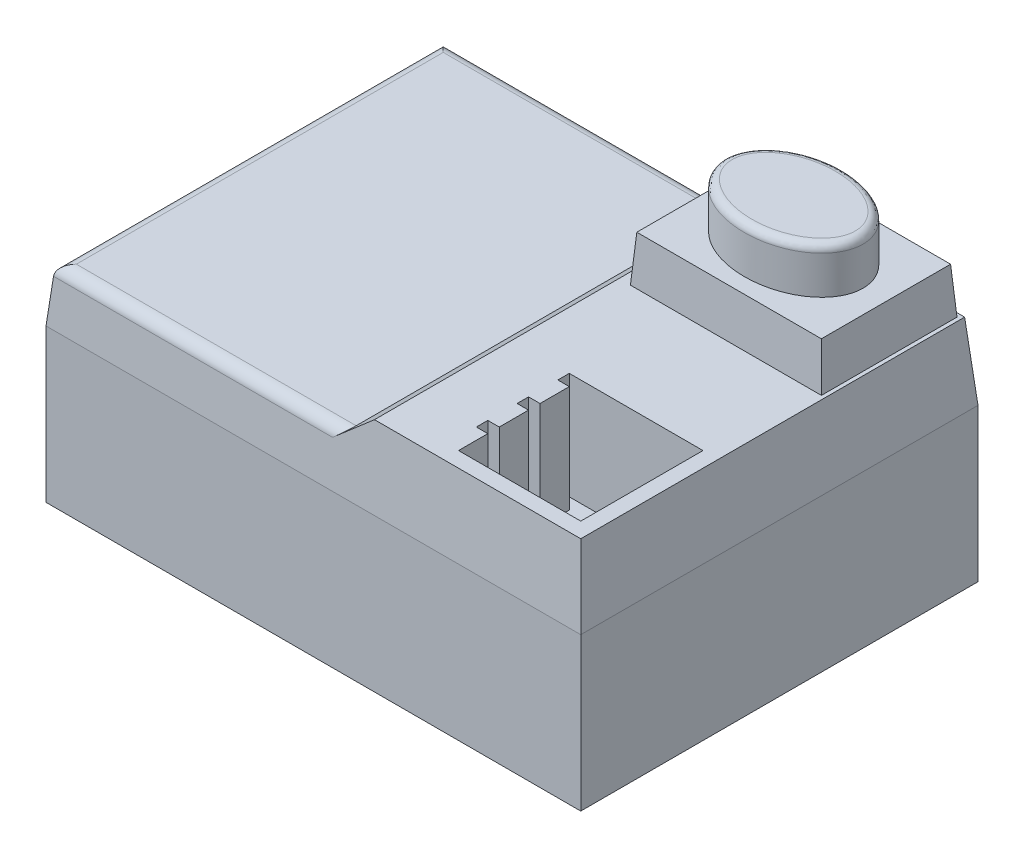
from build123d import *

# Parameters (mm, degrees)
SKETCH1_W           = 35
SKETCH1_H           = 26
BOSS_EXTRUDE1_DEPTH = 10
SKETCH2_W           = 35
SKETCH2_H           = 26
BOSS_EXTRUDE3_DEPTH = 5
BOSS_EXTRUDE3_TAPER = 5
CUT_EXTRUDE1_DEPTH  = 35.745503475
CUT_EXTRUDE2_DEPTH  = 7
SKETCH5_W           = 12.5
SKETCH5_H           = 8.875113364
BOSS_EXTRUDE4_DEPTH = 3
BOSS_EXTRUDE4_TAPER = 4
SKETCH6_RX          = 4.540219564
SKETCH6_RY          = 3.227776247
BOSS_EXTRUDE5_DEPTH = 3
FILLET1_R           = 0.5
FILLET2_R           = 0.75


with BuildPart() as part:
    # Sketch1 → Boss-Extrude1 (new body)
    with BuildSketch(Plane(origin=(0, 0, 0), x_dir=(1, 0, 0), z_dir=(0, 1, 0))):
        Rectangle(SKETCH1_W, SKETCH1_H)
    extrude(amount=BOSS_EXTRUDE1_DEPTH)

    # Sketch2 → Boss-Extrude3 (add)
    with BuildSketch(Plane(origin=(0, 10, 0), x_dir=(1, 0, 0), z_dir=(0, 1, 0))):
        Rectangle(SKETCH2_W, SKETCH2_H)
    extrude(amount=BOSS_EXTRUDE3_DEPTH, taper=BOSS_EXTRUDE3_TAPER)

    # Sketch3 → Cut-Extrude1 (cut, through all)
    with BuildSketch(Plane.XY.offset(13)):
        Polygon((-17.500926093, 15), (3.562556682, 15), (1.806210322, 13.5), (-17.500926093, 13.5), align=None)
    extrude(amount=-CUT_EXTRUDE1_DEPTH, mode=Mode.SUBTRACT)

    # Sketch4 → Cut-Extrude2 (cut)
    with BuildSketch(Plane(origin=(0, 15, 0), x_dir=(1, 0, 0), z_dir=(0, 1, 0))):
        Polygon((8.062556682, -6.229226682), (8.062556682, -4.312556682), (7.312556682, -4.312556682), (7.312556682, -3.562556682), (8.062556682, -3.562556682), (16.062556682, -3.562556682), (16.062556682, -11.562556682), (8.062556682, -11.562556682), (8.062556682, -9.645896682), (7.312556682, -9.645896682), (7.312556682, -8.895896682), (8.062556682, -8.895896682), (8.062556682, -6.979226682), (7.312556682, -6.979226682), (7.312556682, -6.229226682), align=None)
    extrude(amount=-CUT_EXTRUDE2_DEPTH, mode=Mode.SUBTRACT)

    # Sketch5 → Boss-Extrude4 (add)
    with BuildSketch(Plane(origin=(0, 15, 0), x_dir=(1, 0, 0), z_dir=(0, 1, 0))):
        with Locations((10.562556682, 7.875)):
            Rectangle(SKETCH5_W, SKETCH5_H)
    extrude(amount=BOSS_EXTRUDE4_DEPTH, taper=BOSS_EXTRUDE4_TAPER)

    # Sketch6 → Boss-Extrude5 (add)
    with BuildSketch(Plane(origin=(0, 18, 0), x_dir=(1, 0, 0), z_dir=(0, 1, 0))):
        with Locations((10.562556682, 7.875)):
            Ellipse(SKETCH6_RX, SKETCH6_RY)
    extrude(amount=BOSS_EXTRUDE5_DEPTH)

    # Fillet1
    fillet1_edges = [part.edges().sort_by_distance(p)[0] for p in [
        (6.022337953, 21, -7.873042931),
    ]]
    fillet(fillet1_edges, radius=FILLET1_R)

    # Fillet2
    fillet2_edges = [part.edges().sort_by_distance(p)[0] for p in [
        (-7.693789678, 13.5, 12.693789678),
        (-7.693789678, 13.5, -12.693789678),
        (-17.193789678, 13.5, 0),
    ]]
    fillet(fillet2_edges, radius=FILLET2_R)


solid = part.part
